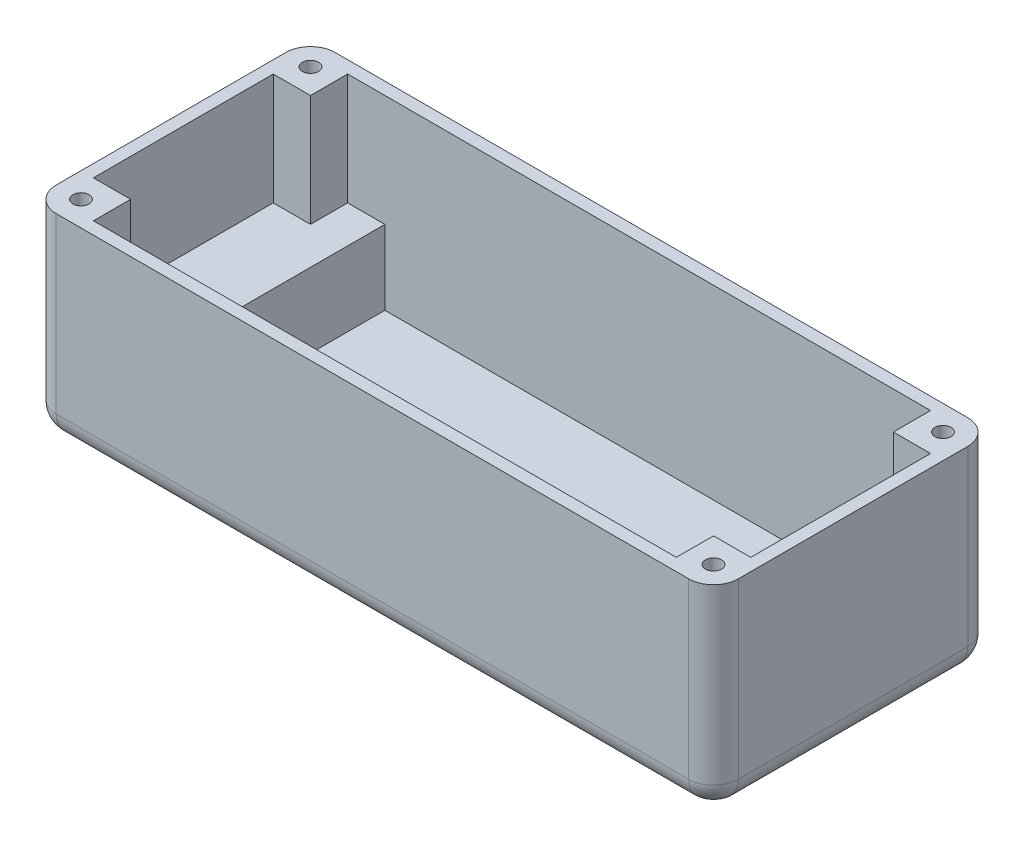
from build123d import *

# Parameters (mm, degrees)
SKETCH1_W           = 110
SKETCH1_H           = 45
BOSS_EXTRUDE1_DEPTH = 2
SKETCH3_W           = 110
SKETCH3_H           = 45
SKETCH3_W_2         = 106
SKETCH3_H_2         = 41
BOSS_EXTRUDE2_DEPTH = 30
SKETCH4_W           = 12
SKETCH4_H           = 41
BOSS_EXTRUDE3_DEPTH = 12
SKETCH5_W           = 6
SKETCH5_H           = 6
BOSS_EXTRUDE4_DEPTH = 18
SKETCH6_W           = 6
SKETCH6_H           = 6
BOSS_EXTRUDE5_DEPTH = 18
FILLET1_R           = 4
FILLET2_R           = 4
SKETCH7_R           = 1.3
CUT_EXTRUDE1_DEPTH  = 34
SKETCH8_R           = 2.9
CUT_EXTRUDE2_DEPTH  = 25
SKETCH9_W           = 10
SKETCH9_H           = 20
CUT_EXTRUDE3_DEPTH  = 10


with BuildPart() as part:
    # Sketch1 → Boss-Extrude1 (new body)
    with BuildSketch(Plane(origin=(0, 0, 0), x_dir=(1, 0, 0), z_dir=(0, 1, 0))):
        Rectangle(SKETCH1_W, SKETCH1_H)
    extrude(amount=BOSS_EXTRUDE1_DEPTH)

    # Sketch3 → Boss-Extrude2 (add)
    with BuildSketch(Plane(origin=(0, 2, 0), x_dir=(1, 0, 0), z_dir=(0, 1, 0))):
        Rectangle(SKETCH3_W, SKETCH3_H)
        Rectangle(SKETCH3_W_2, SKETCH3_H_2, mode=Mode.SUBTRACT)
    extrude(amount=BOSS_EXTRUDE2_DEPTH)

    # Sketch4 → Boss-Extrude3 (add)
    with BuildSketch(Plane(origin=(0, 2, 0), x_dir=(1, 0, 0), z_dir=(0, 1, 0))):
        with Locations((-47, 0)):
            Rectangle(SKETCH4_W, SKETCH4_H)
        with Locations((47, 0)):
            Rectangle(SKETCH4_W, SKETCH4_H)
    extrude(amount=BOSS_EXTRUDE3_DEPTH)

    # Sketch5 → Boss-Extrude4 (add)
    with BuildSketch(Plane(origin=(0, 14, 0), x_dir=(1, 0, 0), z_dir=(0, 1, 0))):
        with Locations((-50, 17.5)):
            Rectangle(SKETCH5_W, SKETCH5_H)
        with Locations((-50, -17.5)):
            Rectangle(SKETCH5_W, SKETCH5_H)
    extrude(amount=BOSS_EXTRUDE4_DEPTH)

    # Sketch6 → Boss-Extrude5 (add)
    with BuildSketch(Plane(origin=(0, 14, 0), x_dir=(1, 0, 0), z_dir=(0, 1, 0))):
        with Locations((50, 17.5)):
            Rectangle(SKETCH6_W, SKETCH6_H)
        with Locations((50, -17.5)):
            Rectangle(SKETCH6_W, SKETCH6_H)
    extrude(amount=BOSS_EXTRUDE5_DEPTH)

    # Fillet1
    fillet1_edges = [part.edges().sort_by_distance(p)[0] for p in [
        (55, 16, 22.5),
        (-55, 16, 22.5),
        (-55, 16, -22.5),
        (55, 16, -22.5),
    ]]
    fillet(fillet1_edges, radius=FILLET1_R)

    # Fillet2
    fillet2_edges = [part.edges().sort_by_distance(p)[0] for p in [
        (0, 0, -22.5),
        (55, 0, 0),
        (0, 0, 22.5),
        (-55, 0, 0),
        (-53.828427125, 0, -21.328427125),
        (-53.828427125, 0, 21.328427125),
        (53.828427125, 0, 21.328427125),
        (53.828427125, 0, -21.328427125),
    ]]
    fillet(fillet2_edges, radius=FILLET2_R)

    # Sketch7 → Cut-Extrude1 (cut)
    with BuildSketch(Plane(origin=(0, 32, 0), x_dir=(1, 0, 0), z_dir=(0, 1, 0))):
        with Locations(Location((-51, 18.5, 0), (0, 0, 270))):
            Circle(SKETCH7_R)
        with Locations(Location((51, 18.5, 0), (0, 0, 270))):
            Circle(SKETCH7_R)
        with Locations(Location((51, -18.5, 0), (0, 0, 270))):
            Circle(SKETCH7_R)
        with Locations(Location((-51, -18.5, 0), (0, 0, 270))):
            Circle(SKETCH7_R)
    extrude(amount=-CUT_EXTRUDE1_DEPTH, mode=Mode.SUBTRACT)

    # Sketch8 → Cut-Extrude2 (cut)
    with BuildSketch(Plane.XZ):
        with Locations(Location((-51, 18.5, 0), (0, 0, 270))):
            Circle(SKETCH8_R)
        with Locations(Location((-51, -18.5, 0), (0, 0, 270))):
            Circle(SKETCH8_R)
        with Locations(Location((51, -18.5, 0), (0, 0, 270))):
            Circle(SKETCH8_R)
        with Locations(Location((51, 18.5, 0), (0, 0, 270))):
            Circle(SKETCH8_R)
    extrude(amount=-CUT_EXTRUDE2_DEPTH, mode=Mode.SUBTRACT)

    # Sketch9 → Cut-Extrude3 (cut)
    with BuildSketch(Plane(origin=(0, 2, 0), x_dir=(1, 0, 0), z_dir=(0, 1, 0))):
        with Locations((36, 0)):
            Rectangle(SKETCH9_W, SKETCH9_H)
    extrude(amount=-CUT_EXTRUDE3_DEPTH, mode=Mode.SUBTRACT)


solid = part.part
